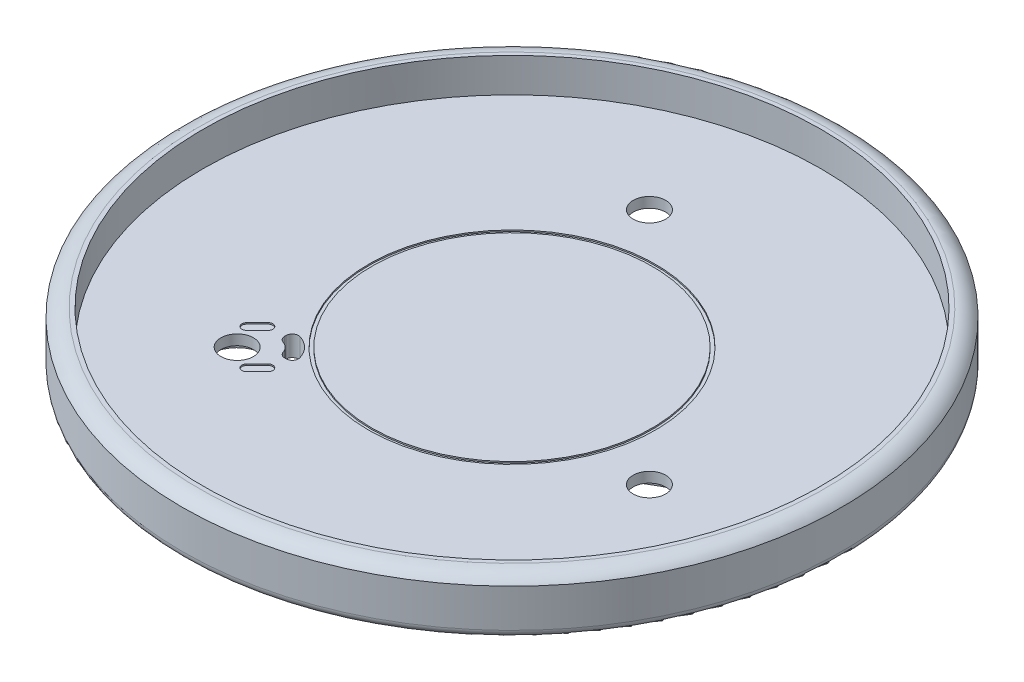
from build123d import *

# Parameters (mm, degrees)
SKETCH_1_R          = 45.2
EXTRUDE_1_DEPTH     = 3
SKETCH_3_R          = 48.2
SKETCH_3_R_2        = 45.2
EXTRUDE_2_DEPTH     = 8
SKETCH_4_R          = 21
SKETCH_4_R_2        = 20.5
CUT_EXTRUDE_1_DEPTH = 0.2
FILLET_2_R          = 1.2
CUT_EXTRUDE_2_DEPTH = 1.5
CUT_EXTRUDE_3_DEPTH = 10
CUT_EXTRUDE_4_DEPTH = 0.2
SKETCH_9_R          = 2.38
CUT_EXTRUDE_5_DEPTH = 10
CUT_EXTRUDE_6_DEPTH = 0.8


with BuildPart() as part:
    # 草图1 → 凸台-拉伸1 (new body)
    with BuildSketch(Plane(origin=(0, 0, 0), x_dir=(1, 0, 0), z_dir=(0, 1, 0))):
        with Locations(Location((0, 0, 0), (0, 0, 270))):
            Circle(SKETCH_1_R)
    extrude(amount=EXTRUDE_1_DEPTH)

    # 草图3 → 凸台-拉伸2 (add)
    with BuildSketch(Plane.XZ):
        with Locations(Location((0, 0, 0), (0, 0, 270))):
            Circle(SKETCH_3_R)
        with Locations(Location((0, 0, 0), (0, 0, 270))):
            Circle(SKETCH_3_R_2, mode=Mode.SUBTRACT)
    extrude(amount=-EXTRUDE_2_DEPTH)

    # 草图4 → 切除-拉伸1 (cut)
    with BuildSketch(Plane(origin=(0, 3, 0), x_dir=(1, 0, 0), z_dir=(0, 1, 0))):
        with Locations(Location((0, 0, 0), (0, 0, 270))):
            Circle(SKETCH_4_R)
        with Locations(Location((0, 0, 0), (0, 0, 270))):
            Circle(SKETCH_4_R_2, mode=Mode.SUBTRACT)
    extrude(amount=-CUT_EXTRUDE_1_DEPTH, mode=Mode.SUBTRACT)

    # 草图5 → 切除-旋转1 (revolve, cut)
    with BuildSketch(Plane(origin=(0, 0, 0), x_dir=(0, 0, -1), z_dir=(1, 0, 0))):
        with BuildLine():
            Line((48.2, 6.8), (48.2, 8))
            Line((48.2, 8), (45.8, 8))
            ThreePointArc((45.8, 8), (47.141640786, 7.683281573), (48.2, 6.8))
        make_face()
    revolve(axis=Axis((0, 0, 0), (0, 1, 0)), mode=Mode.SUBTRACT)

    # 圆角2
    fillet_2_edges = [part.edges().sort_by_distance(p)[0] for p in [
        (0, 0, 48.2),
    ]]
    fillet(fillet_2_edges, radius=FILLET_2_R)

    # 草图6 → 切除-拉伸2 (cut)
    with BuildSketch(Plane.XZ):
        with BuildLine():
            Line((-7.784609691, -34.516660498), (-7.091789368, -34.116660498))
            Line((-7.091789368, -34.116660498), (-3.986078552, -29.842016281))
            ThreePointArc((-3.986078552, -29.842016281), (-3.22762839, -27.700219097), (-3.758044914, -25.490875272))
            Line((-3.758044914, -25.490875272), (-4.856406461, -23.588457268))
            ThreePointArc((-4.856406461, -23.588457268), (-6.070819178, -22.656605616), (-7.588457268, -22.856406461))
            Line((-7.588457268, -22.856406461), (-9.490875272, -23.954768007))
            ThreePointArc((-9.490875272, -23.954768007), (-11.054901368, -25.602907623), (-11.468962853, -27.836983475))
            Line((-11.468962853, -27.836983475), (-10.916660498, -33.091789368))
            Line((-10.916660498, -33.091789368), (-10.516660498, -33.784609691))
            ThreePointArc((-10.516660498, -33.784609691), (-9.302247781, -34.716461343), (-7.784609691, -34.516660498))
        make_face()
        with BuildLine():
            Line((33.784609691, 10.516660498), (33.091789368, 10.916660498))
            Line((33.091789368, 10.916660498), (27.836983475, 11.468962853))
            ThreePointArc((27.836983475, 11.468962853), (25.602907623, 11.054901368), (23.954768007, 9.490875272))
            Line((23.954768007, 9.490875272), (22.856406461, 7.588457268))
            ThreePointArc((22.856406461, 7.588457268), (22.656605616, 6.070819178), (23.588457268, 4.856406461))
            Line((23.588457268, 4.856406461), (25.490875272, 3.758044914))
            ThreePointArc((25.490875272, 3.758044914), (27.700219097, 3.22762839), (29.842016281, 3.986078552))
            Line((29.842016281, 3.986078552), (34.116660498, 7.091789368))
            Line((34.116660498, 7.091789368), (34.516660498, 7.784609691))
            ThreePointArc((34.516660498, 7.784609691), (34.716461343, 9.302247781), (33.784609691, 10.516660498))
        make_face()
        with BuildLine():
            Line((-26, 24), (-26, 23.2))
            Line((-26, 23.2), (-23.850904924, 18.373053428))
            ThreePointArc((-23.850904924, 18.373053428), (-22.375279233, 16.645317728), (-20.196723093, 16))
            Line((-20.196723093, 16), (-18, 16))
            ThreePointArc((-18, 16), (-16.585786438, 16.585786438), (-16, 18))
            Line((-16, 18), (-16, 20.196723093))
            ThreePointArc((-16, 20.196723093), (-16.645317728, 22.375279233), (-18.373053428, 23.850904924))
            Line((-18.373053428, 23.850904924), (-23.2, 26))
            Line((-23.2, 26), (-24, 26))
            ThreePointArc((-24, 26), (-25.414213562, 25.414213562), (-26, 24))
        make_face()
    extrude(amount=-CUT_EXTRUDE_2_DEPTH, mode=Mode.SUBTRACT)

    # 草图7 → 切除-拉伸3 (cut)
    with BuildSketch(Plane.XZ):
        with BuildLine():
            Line((-18, 15.033520605), (-18, 15.24319025))
            ThreePointArc((-18, 15.24319025), (-17.828484492, 15.771688447), (-17.379310345, 16.098751896))
            ThreePointArc((-17.379310345, 16.098751896), (-16.585786438, 16.585786438), (-16.098751896, 17.379310345))
            ThreePointArc((-16.098751896, 17.379310345), (-15.771688447, 17.828484492), (-15.24319025, 18))
            Line((-15.24319025, 18), (-15.033520605, 18))
            ThreePointArc((-15.033520605, 18), (-14.310623209, 17.636115057), (-14.172284652, 16.838709677))
            ThreePointArc((-14.172284652, 16.838709677), (-15.171572875, 15.171572875), (-16.838709677, 14.172284652))
            ThreePointArc((-16.838709677, 14.172284652), (-17.636115057, 14.310623209), (-18, 15.033520605))
        make_face()
    extrude(amount=-CUT_EXTRUDE_3_DEPTH, mode=Mode.SUBTRACT)

    # 草图8 → 切除-拉伸4 (cut)
    with BuildSketch(Plane(origin=(0, 3, 0), x_dir=(1, 0, 0), z_dir=(0, 1, 0))):
        with BuildLine():
            ThreePointArc((-20.952735217, -14.730195543), (-19.962785724, -14.730195543), (-19.962785724, -15.720145037))
            Line((-19.962785724, -15.720145037), (-21.518420642, -17.275779955))
            ThreePointArc((-21.518420642, -17.275779955), (-22.508370136, -17.275779955), (-22.508370136, -16.285830462))
            Line((-22.508370136, -16.285830462), (-20.952735217, -14.730195543))
        make_face()
        with BuildLine():
            Line((-16.285830462, -22.508370136), (-14.730195543, -20.952735217))
            ThreePointArc((-14.730195543, -20.952735217), (-14.730195543, -19.962785724), (-15.720145037, -19.962785724))
            Line((-15.720145037, -19.962785724), (-17.275779955, -21.518420642))
            ThreePointArc((-17.275779955, -21.518420642), (-17.275779955, -22.508370136), (-16.285830462, -22.508370136))
        make_face()
    extrude(amount=-CUT_EXTRUDE_4_DEPTH, mode=Mode.SUBTRACT)

    # 草图9 → 切除-拉伸5 (cut)
    with BuildSketch(Plane(origin=(0, 3, 0), x_dir=(1, 0, 0), z_dir=(0, 1, 0))):
        with Locations(Location((-20.098361546, -20.098361546, 0), (0, 0, 270))):
            Circle(SKETCH_9_R)
        with Locations(Location((-7.3565109, 27.454872447, 0), (0, 0, 270))):
            Circle(SKETCH_9_R)
        with Locations(Location((27.454872447, -7.3565109, 0), (0, 0, 270))):
            Circle(SKETCH_9_R)
    extrude(amount=-CUT_EXTRUDE_5_DEPTH, mode=Mode.SUBTRACT)

    # 草图10 → 切除-拉伸6 (cut)
    # profile 1 of 3: a face of its own
    with BuildSketch(Plane.XZ):
        with BuildLine():
            add(Edge.make_bspline(
                [(-10.079356338, 4.867216538), (-10.179952666, 4.772388159), (-10.375534584, 4.588020433), (-10.693851774, 4.355659746), (-11.022996283, 4.174329259), (-11.360096894, 4.043494065), (-11.700654105, 3.960920857), (-12.041832646, 3.931370423), (-12.381629428, 3.948645726), (-12.718459147, 4.016200632), (-13.049190472, 4.132553617), (-13.367421854, 4.301450609), (-13.677446691, 4.514293305), (-13.863268286, 4.690466362), (-13.958848525, 4.781083725)],
                knots=[0, 0, 0, 0, 1.136115981, 2.208865351, 3.231062099, 4.218092323, 5.174148399, 6.102954762, 7.024583534, 7.962990089, 8.918560302, 9.897073085, 10.918326705, 12, 12, 12, 12], degree=3))
            Line((-13.958848525, 4.781083725), (-16.69048915, 7.51272435))
            add(Edge.make_bspline(
                [(-16.69048915, 7.51272435), (-16.781106513, 7.608304589), (-16.957279571, 7.794126185), (-17.170122266, 8.104151021), (-17.339019259, 8.422382404), (-17.455372243, 8.753113729), (-17.52292715, 9.089943447), (-17.540202452, 9.429740229), (-17.510652018, 9.770918771), (-17.42807881, 10.111475981), (-17.297243616, 10.448576593), (-17.115913129, 10.777721101), (-16.883552443, 11.096038291), (-16.699184716, 11.29162021), (-16.604356338, 11.392216538)],
                knots=[0, 0, 0, 0, 1.081673295, 2.102926915, 3.081439698, 4.037009911, 4.975416466, 5.897045238, 6.825851601, 7.781907677, 8.768937901, 9.791134649, 10.863884019, 12, 12, 12, 12], degree=3))
            add(Edge.make_bspline(
                [(-16.604356338, 11.392216538), (-16.503304185, 11.487801528), (-16.307654295, 11.672866291), (-15.987547331, 11.903617984), (-15.659428783, 12.084731391), (-15.323155572, 12.216270207), (-14.983035171, 12.298474225), (-14.641903529, 12.328022795), (-14.302012057, 12.310984095), (-13.965168422, 12.242391738), (-13.632812434, 12.129583479), (-13.314609234, 11.95952146), (-13.004487435, 11.746957112), (-12.818679533, 11.570744745), (-12.723106338, 11.480107163)],
                knots=[0, 0, 0, 0, 1.142688929, 2.212391883, 3.234380344, 4.216718667, 5.172579933, 6.101197039, 7.022638017, 7.960853358, 8.919188188, 9.897501586, 10.918547111, 12, 12, 12, 12], degree=3))
            Line((-12.723106338, 11.480107163), (-9.991465713, 8.748466538))
            add(Edge.make_bspline(
                [(-9.991465713, 8.748466538), (-9.90082813, 8.652893342), (-9.724615764, 8.46708544), (-9.512051415, 8.156963641), (-9.341989396, 7.838760441), (-9.229181137, 7.506404453), (-9.160588781, 7.169560818), (-9.14355008, 6.829669346), (-9.17309865, 6.488537705), (-9.255302668, 6.148417303), (-9.386841484, 5.812144092), (-9.567954891, 5.484025544), (-9.798706584, 5.16391858), (-9.983771348, 4.968268691), (-10.079356338, 4.867216538)],
                knots=[0, 0, 0, 0, 1.081452889, 2.102498414, 3.080811812, 4.039146642, 4.977361983, 5.898802961, 6.827420067, 7.783281333, 8.765619656, 9.787608117, 10.857311071, 12, 12, 12, 12], degree=3))
        make_face()
        with BuildLine():
            add(Edge.make_bspline(
                [(-11.019786025, 5.807646225), (-10.98473469, 5.844703326), (-10.916164343, 5.91719752), (-10.823640946, 6.031046135), (-10.747945889, 6.15033688), (-10.684794341, 6.270784792), (-10.634164269, 6.393512619), (-10.599669779, 6.519368035), (-10.575473476, 6.647498251), (-10.569865043, 6.777952375), (-10.57432649, 6.908088154), (-10.593614457, 7.036732155), (-10.627875016, 7.161815293), (-10.672815734, 7.284746603), (-10.736292742, 7.402336876), (-10.809586417, 7.519055721), (-10.898468045, 7.632248484), (-10.965861347, 7.703112251), (-11.000450088, 7.739482163)],
                knots=[0, 0, 0, 0, 1.123174975, 2.197248608, 3.224495634, 4.228712617, 5.189549244, 6.14133267, 7.098088556, 8.054322242, 9.009946336, 9.962516613, 10.910882808, 11.862316313, 12.837685189, 13.847111187, 14.895057655, 16, 16, 16, 16], degree=3))
            Line((-11.000450088, 7.739482163), (-13.732090713, 10.471122788))
            add(Edge.make_bspline(
                [(-13.732090713, 10.471122788), (-13.768406192, 10.505799239), (-13.839163901, 10.573363437), (-13.952974526, 10.66092342), (-14.066614635, 10.738339199), (-14.186055372, 10.797871855), (-14.307797815, 10.845547196), (-14.432294648, 10.881800654), (-14.56002391, 10.900028173), (-14.68889703, 10.907785679), (-14.818035153, 10.900700943), (-14.945958652, 10.879433721), (-15.071374739, 10.843783333), (-15.195612662, 10.794665061), (-15.316219789, 10.728189825), (-15.437079192, 10.651543534), (-15.55260447, 10.55712933), (-15.626278359, 10.487412854), (-15.66392665, 10.45178685)],
                knots=[0, 0, 0, 0, 1.102832843, 2.148778623, 3.152483981, 4.120095036, 5.074329331, 6.024295658, 6.962314458, 7.903862974, 8.858271066, 9.798321073, 10.7482874, 11.719235203, 12.727556838, 13.770644404, 14.860771026, 16, 16, 16, 16], degree=3))
            add(Edge.make_bspline(
                [(-15.66392665, 10.45178685), (-15.69957054, 10.414147507), (-15.769322019, 10.340491129), (-15.863485966, 10.224840658), (-15.940876674, 10.104658818), (-16.004199159, 9.982535906), (-16.056517891, 9.859727394), (-16.091388124, 9.73374831), (-16.112942734, 9.605904763), (-16.119702741, 9.476791598), (-16.112938444, 9.34764753), (-16.091139335, 9.221227996), (-16.058532719, 9.096165826), (-16.007608422, 8.976137522), (-15.948928807, 8.85615729), (-15.871246645, 8.742613867), (-15.783761317, 8.628776146), (-15.716186616, 8.558022248), (-15.681504775, 8.521708725)],
                knots=[0, 0, 0, 0, 1.139956555, 2.230779399, 3.274533144, 4.277473055, 5.253900326, 6.204473361, 7.14512374, 8.100141376, 9.042291223, 9.982941603, 10.917658897, 11.877273619, 12.84550265, 13.849849036, 14.896462821, 16, 16, 16, 16], degree=3))
            Line((-15.681504775, 8.521708725), (-12.94986415, 5.7900681))
            add(Edge.make_bspline(
                [(-12.94986415, 5.7900681), (-12.913494298, 5.755478979), (-12.842630649, 5.688084935), (-12.72943705, 5.599208589), (-12.6127212, 5.525895982), (-12.495120272, 5.462486353), (-12.372227476, 5.417302077), (-12.24747227, 5.384069929), (-12.119859838, 5.361420025), (-11.990057725, 5.357922092), (-11.859656032, 5.363301311), (-11.731470465, 5.387462437), (-11.605259501, 5.422471555), (-11.481902104, 5.471721392), (-11.362198976, 5.536405282), (-11.243140221, 5.611410082), (-11.129349581, 5.704048969), (-11.056847274, 5.772603152), (-11.019786025, 5.807646225)],
                knots=[0, 0, 0, 0, 1.105645508, 2.154258869, 3.164327246, 4.140316827, 5.092355806, 6.041325522, 6.983773033, 7.940005267, 8.896847481, 9.854212228, 10.80660135, 11.780025458, 12.773452361, 13.801353106, 14.876110259, 16, 16, 16, 16], degree=3))
        make_face(mode=Mode.SUBTRACT)
    # profile 2 of 3: a face of its own
    with BuildSketch(Plane.XZ):
        with BuildLine():
            add(Edge.make_bspline(
                [(-12.779356338, 7.567216538), (-12.821974949, 7.527992427), (-12.903736257, 7.45274327), (-13.043998221, 7.370961913), (-13.188922028, 7.316975696), (-13.340065898, 7.299784972), (-13.491929993, 7.315862892), (-13.640922547, 7.366441163), (-13.784790754, 7.454074096), (-13.869960047, 7.53273765), (-13.914903213, 7.574247788)],
                knots=[0, 0, 0, 0, 1.078468522, 2.068978668, 3.010058665, 3.94623103, 4.881188457, 5.839340878, 6.859837199, 8, 8, 8, 8], degree=3))
            add(Edge.make_bspline(
                [(-13.914903213, 7.574247788), (-13.955951752, 7.618541183), (-14.03404063, 7.702802926), (-14.11828669, 7.845829791), (-14.168472451, 7.991815823), (-14.18120286, 8.140995248), (-14.156713285, 8.28832961), (-14.102603835, 8.431371538), (-14.01847208, 8.569153861), (-13.943409568, 8.650101445), (-13.904356338, 8.692216538)],
                knots=[0, 0, 0, 0, 1.139675049, 2.168066075, 3.114402787, 4.037609751, 4.968766405, 5.91575196, 6.91561558, 8, 8, 8, 8], degree=3))
            add(Edge.make_bspline(
                [(-13.904356338, 8.692216538), (-13.862243556, 8.731290315), (-13.781300413, 8.806392321), (-13.6434873, 8.89025032), (-13.501180568, 8.945082922), (-13.354221392, 8.966191813), (-13.205149316, 8.956846702), (-13.0584074, 8.906369193), (-12.91495589, 8.821918905), (-12.830685518, 8.74381818), (-12.786387588, 8.702763413)],
                knots=[0, 0, 0, 0, 1.084786176, 2.085020238, 3.032356643, 3.951234827, 4.873918182, 5.831130674, 6.85990271, 8, 8, 8, 8], degree=3))
            add(Edge.make_bspline(
                [(-12.786387588, 8.702763413), (-12.744877361, 8.657817276), (-12.666213638, 8.572642351), (-12.578290451, 8.428333959), (-12.527711566, 8.27865688), (-12.51405244, 8.126586462), (-12.531479619, 7.976632831), (-12.582621019, 7.831469363), (-12.665046618, 7.691658532), (-12.740188267, 7.609856419), (-12.779356338, 7.567216538)],
                knots=[0, 0, 0, 0, 1.140905902, 2.162067331, 3.131221777, 4.065699465, 4.991612349, 5.929672876, 6.920828586, 8, 8, 8, 8], degree=3))
        make_face()
    # profile 3 of 3: a face of its own
    with BuildSketch(Plane.XZ):
        with BuildLine():
            Line((-6.089888, 9.081684875), (-7.185005188, 13.101802063))
            add(Edge.make_bspline(
                [(-7.185005188, 13.101802063), (-7.19578807, 13.039929675), (-7.218162378, 12.911545467), (-7.272460158, 12.751514826), (-7.338653345, 12.615365136), (-7.418783833, 12.504464954), (-7.518441096, 12.380591446), (-7.597886794, 12.299541891), (-7.640278625, 12.25629425)],
                knots=[0, 0, 0, 0, 1.15087976, 2.388057002, 3.085015606, 3.919762189, 4.889995414, 6, 6, 6, 6], degree=3))
            add(Edge.make_bspline(
                [(-7.640278625, 12.25629425), (-7.72719068, 12.175134127), (-7.898207136, 12.015435721), (-8.190051384, 11.823377405), (-8.498798041, 11.670093805), (-8.826370999, 11.563307856), (-9.164626982, 11.501708402), (-9.508145721, 11.485665027), (-9.854417225, 11.516518903), (-10.200748033, 11.592294665), (-10.543451283, 11.714355145), (-10.871877809, 11.892456058), (-11.190406243, 12.114405251), (-11.38249751, 12.295284134), (-11.481098938, 12.388130188)],
                knots=[0, 0, 0, 0, 0.995361735, 1.958568759, 2.916387292, 3.877926988, 4.836601661, 5.790583351, 6.752085405, 7.742562585, 8.7556567, 9.790675602, 10.865942505, 12, 12, 12, 12], degree=3))
            add(Edge.make_bspline(
                [(-11.481098938, 12.388130188), (-11.531409404, 12.440395256), (-11.63042906, 12.543261906), (-11.768068516, 12.703331305), (-11.891590743, 12.867007656), (-12.000777485, 13.034759207), (-12.097721959, 13.205545026), (-12.182338998, 13.379086748), (-12.252835992, 13.556116813), (-12.329964139, 13.793273629), (-12.393013187, 14.095571323), (-12.416409254, 14.462600726), (-12.385798575, 14.83020562), (-12.316562869, 15.133275875), (-12.23527612, 15.373029586), (-12.159431354, 15.551885258), (-12.071383071, 15.728027002), (-11.970483786, 15.901262586), (-11.856480515, 16.071902295), (-11.726961579, 16.238524401), (-11.587168665, 16.404290569), (-11.485247926, 16.509605978), (-11.433638, 16.562934875)],
                knots=[0, 0, 0, 0, 0.924174017, 1.818933536, 2.687908239, 3.53479611, 4.367247617, 5.188612081, 5.992661064, 6.792993127, 8.364013572, 9.912397376, 11.462939308, 13.047611613, 13.859729909, 14.686100264, 15.520758185, 16.367119425, 17.238815634, 18.133232507, 19.054719044, 20, 20, 20, 20], degree=3))
            add(Edge.make_bspline(
                [(-11.433638, 16.562934875), (-11.380315511, 16.614554118), (-11.275012756, 16.716493254), (-11.109154415, 16.856152158), (-10.943123747, 16.985959183), (-10.771150363, 17.098344406), (-10.597290152, 17.19841951), (-10.421227639, 17.287296994), (-10.241414164, 17.361374373), (-9.999536268, 17.439883799), (-9.693784029, 17.50810046), (-9.323119216, 17.537467867), (-8.952664406, 17.50942735), (-8.647370896, 17.444361618), (-8.407033357, 17.364123828), (-8.227295923, 17.29276377), (-8.051714295, 17.205743342), (-7.878527034, 17.107475887), (-7.710077266, 16.99431221), (-7.543967479, 16.86878744), (-7.380652916, 16.730415046), (-7.27644957, 16.629740552), (-7.223677063, 16.578755188)],
                knots=[0, 0, 0, 0, 0.937650643, 1.851698935, 2.738896069, 3.599455669, 4.445394411, 5.273314968, 6.090166748, 6.900412968, 8.485131637, 10.037335856, 11.581606338, 13.164749782, 13.967960741, 14.782021812, 15.606657286, 16.442488091, 17.296876433, 18.169207729, 19.072817687, 20, 20, 20, 20], degree=3))
            add(Edge.make_bspline(
                [(-7.223677063, 16.578755188), (-7.161368803, 16.51253371), (-7.031307745, 16.374304276), (-6.856394687, 16.135026517), (-6.684486897, 15.864876954), (-6.524565746, 15.562478776), (-6.370558248, 15.23767193), (-6.228289412, 14.893816892), (-6.097402053, 14.534034039), (-6.023586103, 14.285804797), (-5.986177063, 14.160005188)],
                knots=[0, 0, 0, 0, 0.79511786, 1.659713659, 2.588704217, 3.595925975, 4.651115987, 5.733931579, 6.851583634, 8, 8, 8, 8], degree=3))
            Line((-5.986177063, 14.160005188), (-4.850630188, 10.320942688))
            Line((-4.850630188, 10.320942688), (-6.089888, 9.081684875))
        make_face()
        with BuildLine():
            add(Edge.make_bspline(
                [(-8.283638, 13.412934875), (-8.245345082, 13.452667981), (-8.170509159, 13.530318466), (-8.073419221, 13.656765529), (-7.990455056, 13.785591917), (-7.924962479, 13.919319186), (-7.873854814, 14.05527888), (-7.835530086, 14.194494978), (-7.817481175, 14.338169751), (-7.811547976, 14.483549072), (-7.822124512, 14.629808947), (-7.84911735, 14.773874064), (-7.888981946, 14.916531659), (-7.948631333, 15.055106895), (-8.020135787, 15.192940521), (-8.108971021, 15.326815243), (-8.213325449, 15.457784295), (-8.292319062, 15.539923544), (-8.33285675, 15.5820755)],
                knots=[0, 0, 0, 0, 1.080990267, 2.112581329, 3.119513919, 4.080111029, 5.025200219, 5.964126936, 6.903053654, 7.857035381, 8.812882313, 9.770384153, 10.726507102, 11.709907657, 12.722067706, 13.767001326, 14.854076928, 16, 16, 16, 16], degree=3))
            add(Edge.make_bspline(
                [(-8.33285675, 15.5820755), (-8.374432146, 15.622008387), (-8.455420646, 15.699797294), (-8.584506608, 15.802682281), (-8.717338383, 15.888918314), (-8.851799113, 15.962218599), (-8.991300578, 16.015818263), (-9.131623871, 16.060179796), (-9.276618984, 16.083185418), (-9.422545228, 16.094820123), (-9.567986295, 16.088602856), (-9.711644789, 16.070628842), (-9.850865231, 16.032284128), (-9.98682375, 15.981181868), (-10.120551342, 15.915687803), (-10.249377639, 15.832724059), (-10.375824727, 15.735634004), (-10.453475208, 15.660798098), (-10.493208313, 15.622505188)],
                knots=[0, 0, 0, 0, 1.135116728, 2.211197249, 3.245170986, 4.25199197, 5.220716794, 6.184686012, 7.144778291, 8.105217362, 9.063782268, 10.007219835, 10.950657402, 11.900287049, 12.865499119, 13.877269277, 14.913816372, 16, 16, 16, 16], degree=3))
            add(Edge.make_bspline(
                [(-10.493208313, 15.622505188), (-10.531471609, 15.582754408), (-10.606249641, 15.505069383), (-10.703259929, 15.379511461), (-10.784523647, 15.250315656), (-10.852071511, 15.118335226), (-10.903912804, 14.981669748), (-10.938168727, 14.841010833), (-10.960143328, 14.69750353), (-10.96528432, 14.55180987), (-10.953996568, 14.405905719), (-10.930689551, 14.260993622), (-10.887125935, 14.120104044), (-10.830310507, 13.98202894), (-10.760163762, 13.846062609), (-10.673190505, 13.713900426), (-10.570553129, 13.584691303), (-10.492729392, 13.503720127), (-10.452778625, 13.462153625)],
                knots=[0, 0, 0, 0, 1.086312438, 2.122982458, 3.118946779, 4.08943534, 5.039177604, 5.991021844, 6.936193786, 7.894872369, 8.855425338, 9.815631475, 10.77971501, 11.752877004, 12.754444169, 13.788540525, 14.864748658, 16, 16, 16, 16], degree=3))
            add(Edge.make_bspline(
                [(-10.452778625, 13.462153625), (-10.410626668, 13.421615928), (-10.328487415, 13.342622297), (-10.197518385, 13.238267996), (-10.063643587, 13.14943231), (-9.925810229, 13.077929462), (-9.787234037, 13.018274334), (-9.644579894, 12.97843048), (-9.500501957, 12.951360606), (-9.354289844, 12.94107107), (-9.208651112, 12.945943951), (-9.06512928, 12.967989469), (-8.924474263, 13.002226363), (-8.787807736, 13.054072778), (-8.655827595, 13.121619235), (-8.526631709, 13.202883345), (-8.401073809, 13.299893524), (-8.323388782, 13.374671571), (-8.283638, 13.412934875)],
                knots=[0, 0, 0, 0, 1.145983405, 2.233116242, 3.278104879, 4.290318219, 5.27377055, 6.229943839, 7.187496093, 8.14339335, 9.097425306, 10.038016087, 10.985246826, 11.930385776, 12.896170468, 13.887307443, 14.918952818, 16, 16, 16, 16], degree=3))
        make_face(mode=Mode.SUBTRACT)
    extrude(amount=-CUT_EXTRUDE_6_DEPTH, mode=Mode.SUBTRACT)


solid = part.part
